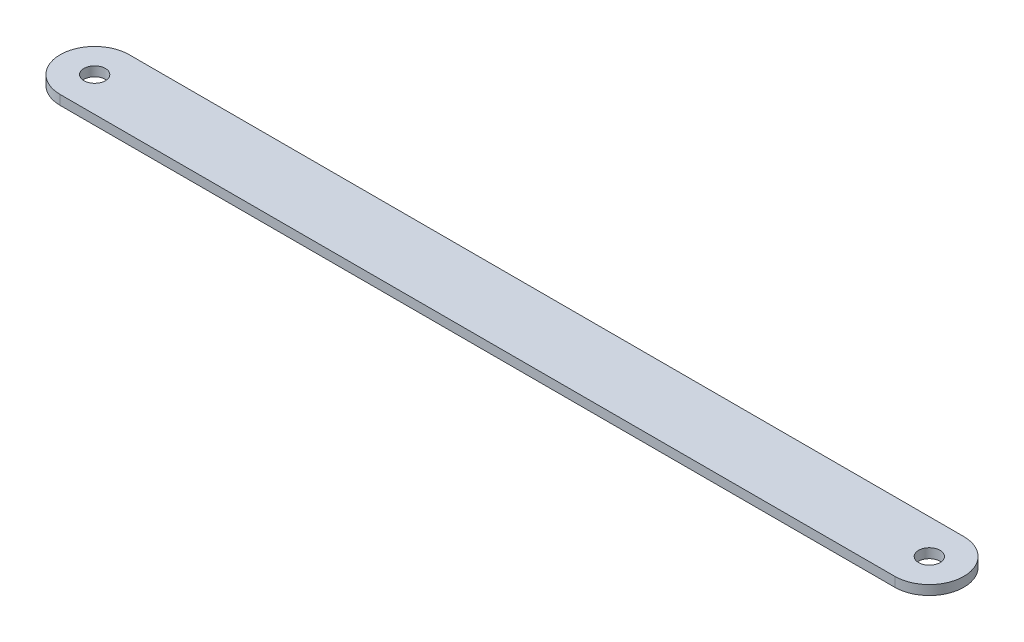
from build123d import *

# Parameters (mm, degrees)
SKETCH1_R           = 4.5
SKETCH1_R_2         = 6.5
SKETCH1_R_3         = 1.75
BOSS_EXTRUDE1_DEPTH = 4
SKETCH2_R           = 2
CUT_EXTRUDE1_DEPTH  = 4
SKETCH3_R           = 2
CUT_EXTRUDE2_DEPTH  = 10
CUT_EXTRUDE3_START  = -10
CUT_EXTRUDE3_DEPTH  = 10


with BuildPart() as part:
    # Sketch1 → Boss-Extrude1 (new body)
    with BuildSketch(Plane(origin=(0, 0, 0), x_dir=(1, 0, 0), z_dir=(0, 1, 0))):
        with BuildLine():
            Line((-270, -14.5), (0, -14.5))
            Line((0, -14.5), (0, 340))
            Line((0, 340), (-175.463800793, 340))
            ThreePointArc((-175.463800793, 340), (-185.71684912, 335.753048327), (-189.963800793, 325.5))
            Line((-189.963800793, 325.5), (-189.963800793, 225.606590828))
            ThreePointArc((-189.963800793, 225.606590828), (-204.963800793, 210.606590828), (-189.963800793, 195.606590828))
            Line((-189.963800793, 195.606590828), (-189.963800793, 54.5))
            Line((-189.963800793, 54.5), (-229.963800793, 14.5))
            Line((-229.963800793, 14.5), (-270, 14.5))
            ThreePointArc((-270, 14.5), (-284.5, 0), (-270, -14.5))
        make_face()
        with Locations(Location((-270, 0, 0), (0, 0, 270))):
            Circle(SKETCH1_R, mode=Mode.SUBTRACT)
        with Locations(Location((-175.463800793, 325.5, 0), (0, 0, 270))):
            Circle(SKETCH1_R, mode=Mode.SUBTRACT)
        with Locations(Location((-189.963800793, 210.606590828, 0), (0, 0, 270))):
            Circle(SKETCH1_R_2, mode=Mode.SUBTRACT)
        with Locations(Location((-180.213800793, 210.606590828, 0), (0, 0, 270))):
            Circle(SKETCH1_R_3, mode=Mode.SUBTRACT)
        with Locations(Location((-189.963800793, 220.406590828, 0), (0, 0, 270))):
            Circle(SKETCH1_R_3, mode=Mode.SUBTRACT)
        with Locations(Location((-189.963800793, 200.806590828, 0), (0, 0, 270))):
            Circle(SKETCH1_R_3, mode=Mode.SUBTRACT)
        with Locations(Location((-199.713800793, 210.606590828, 0), (0, 0, 270))):
            Circle(SKETCH1_R_3, mode=Mode.SUBTRACT)
    boss_extrude1 = extrude(amount=BOSS_EXTRUDE1_DEPTH)

    # Mirror1: Boss-Extrude1 across plane
    add(boss_extrude1.mirror(Plane(origin=(0, 4, -340), x_dir=(0, 0, 1), z_dir=(-1, 0, 0))))

    # Sketch2 → Cut-Extrude1 (cut)
    with BuildSketch(Plane(origin=(0, 4, 0), x_dir=(1, 0, 0), z_dir=(0, 1, 0))):
        with Locations(Location((0, 305.5, 0), (0, 0, 270))):
            Circle(SKETCH2_R)
    extrude(amount=-CUT_EXTRUDE1_DEPTH, mode=Mode.SUBTRACT)

    # Sketch3 → Cut-Extrude2 (cut)
    with BuildSketch(Plane(origin=(0, 4, 0), x_dir=(1, 0, 0), z_dir=(0, 1, 0))):
        with Locations(Location((-170, 15.5, 0), (0, 0, 270))):
            Circle(SKETCH3_R)
        with Locations(Location((170, 15.5, 0), (0, 0, 270))):
            Circle(SKETCH3_R)
    extrude(amount=-CUT_EXTRUDE2_DEPTH, mode=Mode.SUBTRACT)

    # Sketch4 → Cut-Extrude3 (cut)
    with BuildSketch(Plane(origin=(0, 4, 0), x_dir=(1, 0, 0), z_dir=(0, 1, 0)).offset(CUT_EXTRUDE3_START)):
        with BuildLine():
            Line((-175.463800793, 311), (175.463800793, 311))
            ThreePointArc((175.463800793, 311), (185.71684912, 315.246951673), (189.963800793, 325.5))
            Line((189.963800793, 325.5), (382.257646385, 325.5))
            Line((382.257646385, 325.5), (382.257646385, -89.216188956))
            Line((382.257646385, -89.216188956), (-350.501872642, -89.216188956))
            Line((-350.501872642, -89.216188956), (-350.501872642, 325.5))
            Line((-350.501872642, 325.5), (-189.963800793, 325.5))
            ThreePointArc((-189.963800793, 325.5), (-185.71684912, 315.246951673), (-175.463800793, 311))
        make_face()
    extrude(amount=CUT_EXTRUDE3_DEPTH, mode=Mode.SUBTRACT)


solid = part.part
